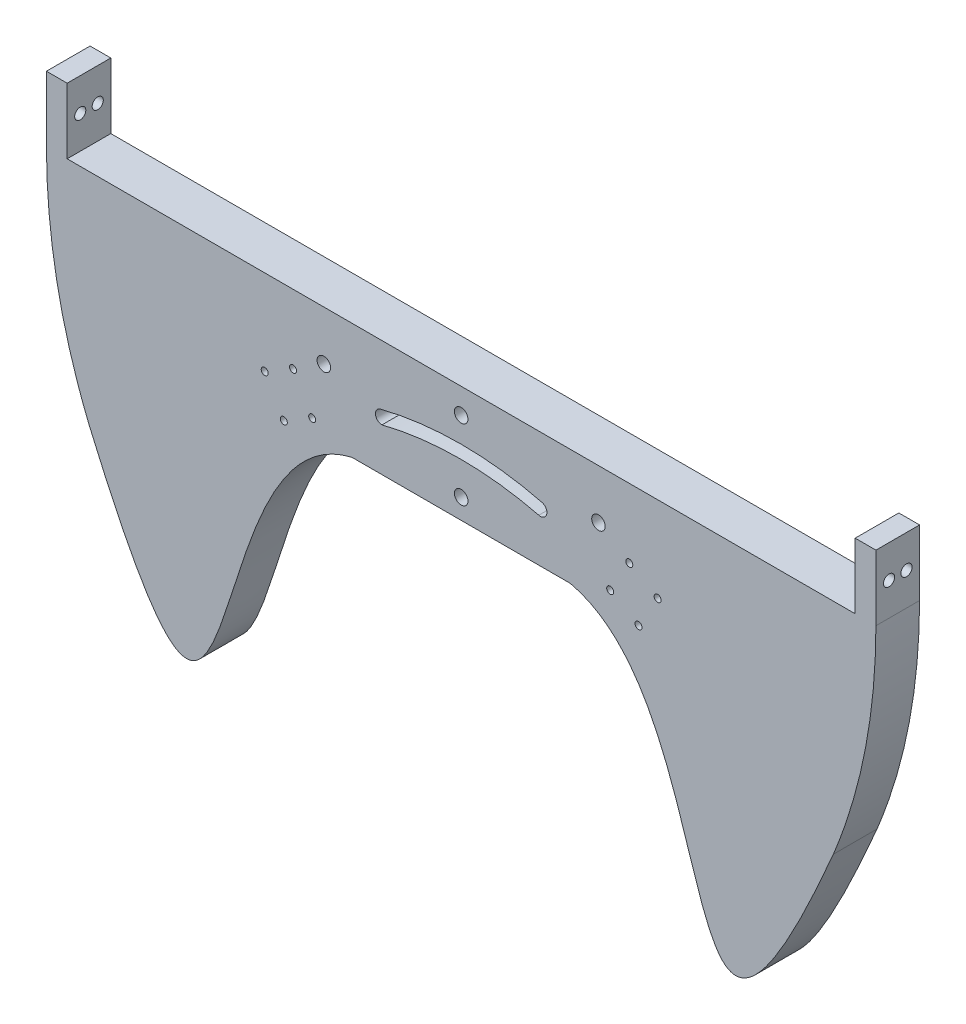
from build123d import *

# Parameters (mm, degrees)
SKETCH_1_R               = 3.1
SKETCH_1_R_2             = 1.6
EXTRUDE_1_DEPTH          = 10
SKETCH_7_W               = 9.5
SKETCH_7_H               = 20
EXTRUDE_2_DEPTH          = 30
CUT_EXTRUDE_1_DEPTH      = 399.034023277
CUT_EXTRUDE_1_DEPTH_BACK = 399.034023277
SKETCH_8_R               = 2.55


with BuildPart() as part:
    # 草图1 → 凸台-拉伸1 (new, symmetric)
    # profile 1 of 3: a face of its own
    with BuildSketch(Plane.XY):
        with BuildLine():
            Line((-49.723400677, 34.824923839), (50.276599325, 34.824923839))
            add(Edge.make_bspline(
                [(50.276599325, 34.824923839), (124.566445362, 17.843319342), (95.555290462, -188.079366879), (170.787580761, -12.360236435)],
                knots=[0, 0, 0, 0, 1, 1, 1, 1], degree=3))
            ThreePointArc((170.787580761, -12.360236435), (0.276599325, 88.030011373), (-170.23438211, -12.360236435))
            add(Edge.make_bspline(
                [(-49.723400677, 34.824923839), (-124.01324671, 17.843319337), (-95.002091812, -188.079366877), (-170.23438211, -12.360236435)],
                knots=[0, 0, 0, 0, 1, 1, 1, 1], degree=3))
        make_face()
        with Locations((-62.62746254, 65.411358975)):
            Circle(SKETCH_1_R, mode=Mode.SUBTRACT)
        with Locations((-76.733019619, 56.414584056)):
            Circle(SKETCH_1_R_2, mode=Mode.SUBTRACT)
        with Locations((-89.723400674, 48.914584057)):
            Circle(SKETCH_1_R_2, mode=Mode.SUBTRACT)
        with Locations((-67.983019619, 41.25913949)):
            Circle(SKETCH_1_R_2, mode=Mode.SUBTRACT)
        with Locations((-80.973400674, 33.759139488)):
            Circle(SKETCH_1_R_2, mode=Mode.SUBTRACT)
        with Locations((0.276599325, 76.530011374)):
            Circle(SKETCH_1_R, mode=Mode.SUBTRACT)
        with Locations((0.276599325, 44.030011375)):
            Circle(SKETCH_1_R, mode=Mode.SUBTRACT)
        with Locations((63.180661188, 65.411358975)):
            Circle(SKETCH_1_R, mode=Mode.SUBTRACT)
        with Locations((77.286218268, 56.414584056)):
            Circle(SKETCH_1_R_2, mode=Mode.SUBTRACT)
        with Locations((90.276599325, 48.914584057)):
            Circle(SKETCH_1_R_2, mode=Mode.SUBTRACT)
        with Locations((81.526599324, 33.759139488)):
            Circle(SKETCH_1_R_2, mode=Mode.SUBTRACT)
        with Locations((68.536218267, 41.25913949)):
            Circle(SKETCH_1_R_2, mode=Mode.SUBTRACT)
        with BuildLine():
            ThreePointArc((-36.011685017, 54.574370317), (-0.091755893, 59.031248881), (35.839117979, 54.663483137))
            ThreePointArc((35.839117979, 54.663483137), (39.472360183, 56.849455003), (37.290649352, 60.485257494))
            ThreePointArc((37.290649352, 60.485257494), (0.276599325, 65.052037292), (-36.737450702, 60.485257494))
            ThreePointArc((-36.737450702, 60.485257494), (-38.986236568, 57.209141311), (-36.011685017, 54.574370317))
        make_face(mode=Mode.SUBTRACT)
    # profile 2 of 3: a face of its own
    with BuildSketch(Plane.XY):
        with BuildLine():
            add(Edge.make_bspline(
                [(-189.723400675, 88.030011373), (-189.61780162, 34.842552906), (-170.23438211, -12.360236435)],
                knots=[0, 0, 0, 0.9050572, 0.9050572, 0.9050572], degree=2))
            ThreePointArc((-170.23438211, -12.360236435), (-98.657970523, 61.068551265), (0.276599915, 88.030011373))
            Line((0.276599915, 88.030011373), (-189.723400675, 88.030011373))
        make_face()
    # profile 3 of 3: a face of its own
    with BuildSketch(Plane.XY):
        with BuildLine():
            ThreePointArc((0.276599915, 88.030011373), (99.211169681, 61.068550966), (170.787580761, -12.360236435))
            add(Edge.make_bspline(
                [(190.276599325, 88.030011373), (190.171000271, 34.842552906), (170.787580761, -12.360236435)],
                knots=[0, 0, 0, 0.9050572, 0.9050572, 0.9050572], degree=2))
            Line((190.276599325, 88.030011373), (0.276599915, 88.030011373))
        make_face()
    extrude(amount=EXTRUDE_1_DEPTH, both=True)

    # 草图7 → 凸台-拉伸2 (add)
    with BuildSketch(Plane(origin=(0, 88.030011373, 0), x_dir=(1, 0, 0), z_dir=(0, 1, 0))):
        with Locations((-184.973400675, 0)):
            Rectangle(SKETCH_7_W, SKETCH_7_H)
        with Locations((185.526599325, 0)):
            Rectangle(SKETCH_7_W, SKETCH_7_H)
    extrude(amount=EXTRUDE_2_DEPTH)

    # 草图8 → 切除-拉伸1 (cut, two sides: drawn at the far end of the back side and taken through both)
    with BuildSketch(Plane.ZY.offset(189.723400675).offset(-CUT_EXTRUDE_1_DEPTH_BACK)):
        with Locations((-4, 103.030011373)):
            Circle(SKETCH_8_R)
        with Locations((4, 103.030011373)):
            Circle(SKETCH_8_R)
    extrude(amount=CUT_EXTRUDE_1_DEPTH + CUT_EXTRUDE_1_DEPTH_BACK, mode=Mode.SUBTRACT)


solid = part.part
